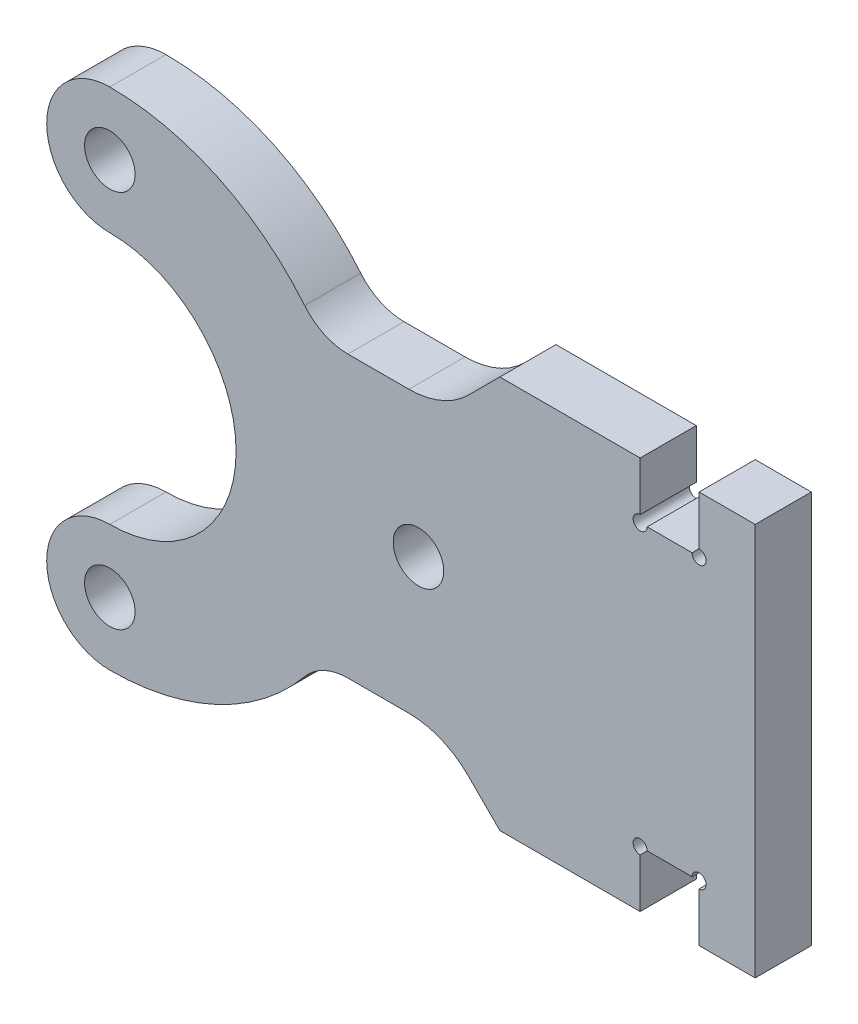
from build123d import *

# Parameters (mm, degrees)
SKETCH_1_R      = 0.9
EXTRUDE_1_DEPTH = 2


with BuildPart() as part:
    # 草图1 → 凸台-拉伸1 (new body)
    with BuildSketch(Plane.XY):
        with BuildLine():
            Line((8.485281374, -5), (10.657359313, -5))
            ThreePointArc((10.657359313, -5), (11.80540961, -5.228361402), (12.778679656, -5.878679656))
            Line((12.778679656, -5.878679656), (13.9, -7))
            Line((13.9, -7), (18.9, -7))
            Line((18.9, -7), (18.9, -5.25))
            ThreePointArc((18.9, -5.25), (18.723223305, -4.823223305), (19.15, -5))
            Line((19.15, -5), (20.75, -5))
            ThreePointArc((20.75, -5), (21.176776695, -4.823223305), (21, -5.25))
            Line((21, -5.25), (21, -7))
            Line((21, -7), (23, -7))
            Line((23, -7), (23, 7))
            Line((23, 7), (21, 7))
            Line((21, 7), (21, 5.25))
            ThreePointArc((21, 5.25), (21.176776695, 4.823223305), (20.75, 5))
            Line((20.75, 5), (19.15, 5))
            ThreePointArc((19.15, 5), (18.723223305, 4.823223305), (18.9, 5.25))
            Line((18.9, 5.25), (18.9, 7))
            Line((18.9, 7), (13.9, 7))
            Line((13.9, 7), (12.778679656, 5.878679656))
            ThreePointArc((12.778679656, 5.878679656), (11.80540961, 5.228361402), (10.657359313, 5))
            Line((10.657359313, 5), (8.485281374, 5))
            ThreePointArc((8.485281374, 5), (7.632478509, 5.190931933), (6.942502943, 5.727272727))
            ThreePointArc((6.942502943, 5.727272727), (3.837612894, 8.140806304), (0, 9))
            ThreePointArc((0, 9), (-2.25, 6.75), (0, 4.5))
            ThreePointArc((0, 4.5), (4.5, 0), (0, -4.5))
            ThreePointArc((0, -4.5), (-2.25, -6.75), (0, -9))
            ThreePointArc((0, -9), (3.837612894, -8.140806304), (6.942502943, -5.727272727))
            ThreePointArc((6.942502943, -5.727272727), (7.632478509, -5.190931933), (8.485281374, -5))
        make_face()
        with Locations((0, 6.75)):
            Circle(SKETCH_1_R, mode=Mode.SUBTRACT)
        with Locations((0, -6.75)):
            Circle(SKETCH_1_R, mode=Mode.SUBTRACT)
        with Locations((11, 0)):
            Circle(SKETCH_1_R, mode=Mode.SUBTRACT)
    extrude(amount=EXTRUDE_1_DEPTH)


solid = part.part
